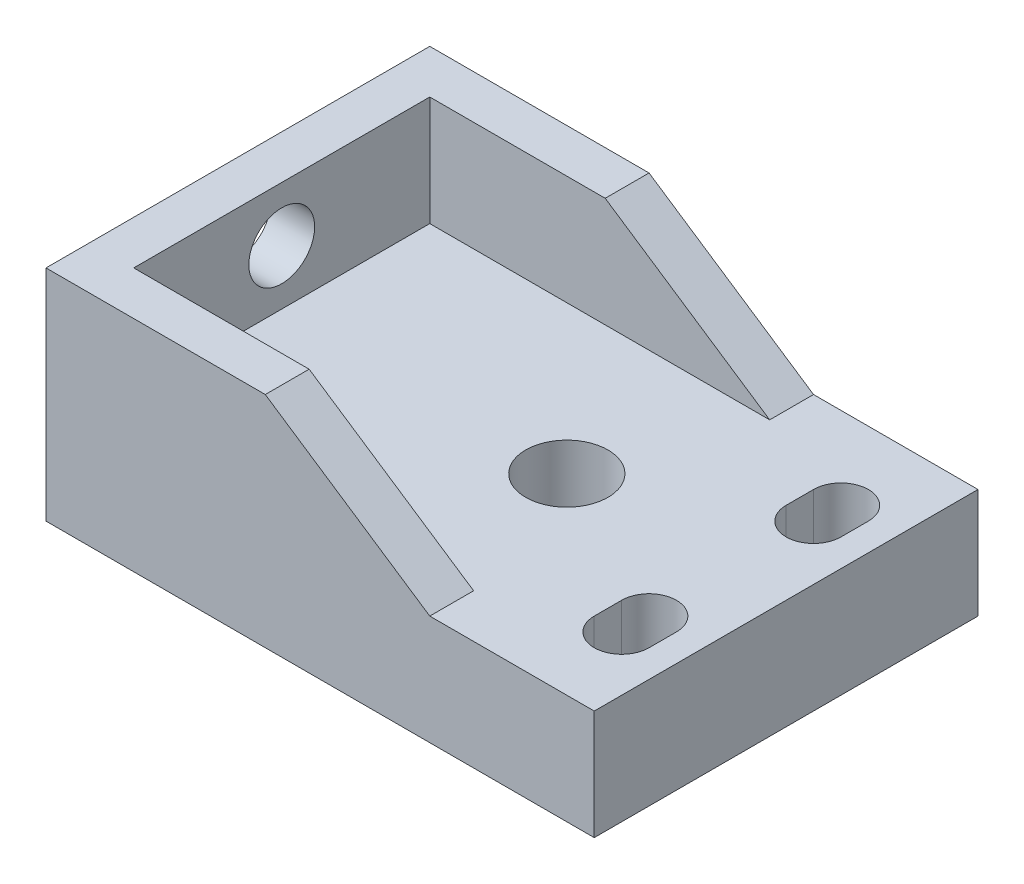
from build123d import *

# Parameters (mm, degrees)
EXTRUDE_1_DEPTH     = 70
SKETCH_2_W          = 84
SKETCH_2_H          = 54
CUT_EXTRUDE_1_DEPTH = 20
SKETCH_3_R          = 7.5
CUT_EXTRUDE_2_DEPTH = 89.317608663
CUT_EXTRUDE_3_DEPTH = 89.317608663
SKETCH_4_R          = 6
CUT_EXTRUDE_4_DEPTH = 118.320075008


with BuildPart() as part:
    # Эскиз1 → Бобышка-Вытянуть1 (new body)
    with BuildSketch(Plane.XY):
        Polygon((50, -20), (50, 0), (20, 0), (-10, 20), (-50, 20), (-50, -20), align=None)
    extrude(amount=EXTRUDE_1_DEPTH)

    # Эскиз2 → Вырез-Вытянуть1 (cut)
    with BuildSketch(Plane(origin=(0, 20, 0), x_dir=(1, 0, 0), z_dir=(0, 1, 0))):
        with Locations((0, -35)):
            Rectangle(SKETCH_2_W, SKETCH_2_H)
    extrude(amount=-CUT_EXTRUDE_1_DEPTH, mode=Mode.SUBTRACT)

    # Эскиз3 → Вырез-Вытянуть2 (cut, through all)
    with BuildSketch(Plane(origin=(0, 0, 0), x_dir=(1, 0, 0), z_dir=(0, 1, 0))):
        with Locations(Location((10, -35, 0), (0, 0, 180))):
            Circle(SKETCH_3_R)
    extrude(amount=-CUT_EXTRUDE_2_DEPTH, mode=Mode.SUBTRACT)

    # Эскиз3<4> → Вырез-Вытянуть3 (cut, through all)
    with BuildSketch(Plane(origin=(0, 0, 0), x_dir=(1, 0, 0), z_dir=(0, 1, 0))):
        with BuildLine():
            Line((35, -20), (35, -15))
            ThreePointArc((35, -15), (40, -10), (45, -15))
            Line((45, -15), (45, -20))
            ThreePointArc((45, -20), (40, -25), (35, -20))
        make_face()
    cut_extrude_3 = extrude(amount=-CUT_EXTRUDE_3_DEPTH, mode=Mode.SUBTRACT)

    # Зеркальное отражение1: Вырез-Вытянуть3 across plane
    add(cut_extrude_3.mirror(Plane(origin=(0, 0, 35), x_dir=(1, 0, 0), z_dir=(0, 0, -1))), mode=Mode.SUBTRACT)

    # Эскиз4 → Вырез-Вытянуть4 (cut, through all)
    with BuildSketch(Plane(origin=(-42, 0, 0), x_dir=(0, 0, -1), z_dir=(1, 0, 0))):
        with Locations(Location((-35, 10, 0), (0, 0, 90))):
            Circle(SKETCH_4_R)
    extrude(amount=-CUT_EXTRUDE_4_DEPTH, mode=Mode.SUBTRACT)


solid = part.part
